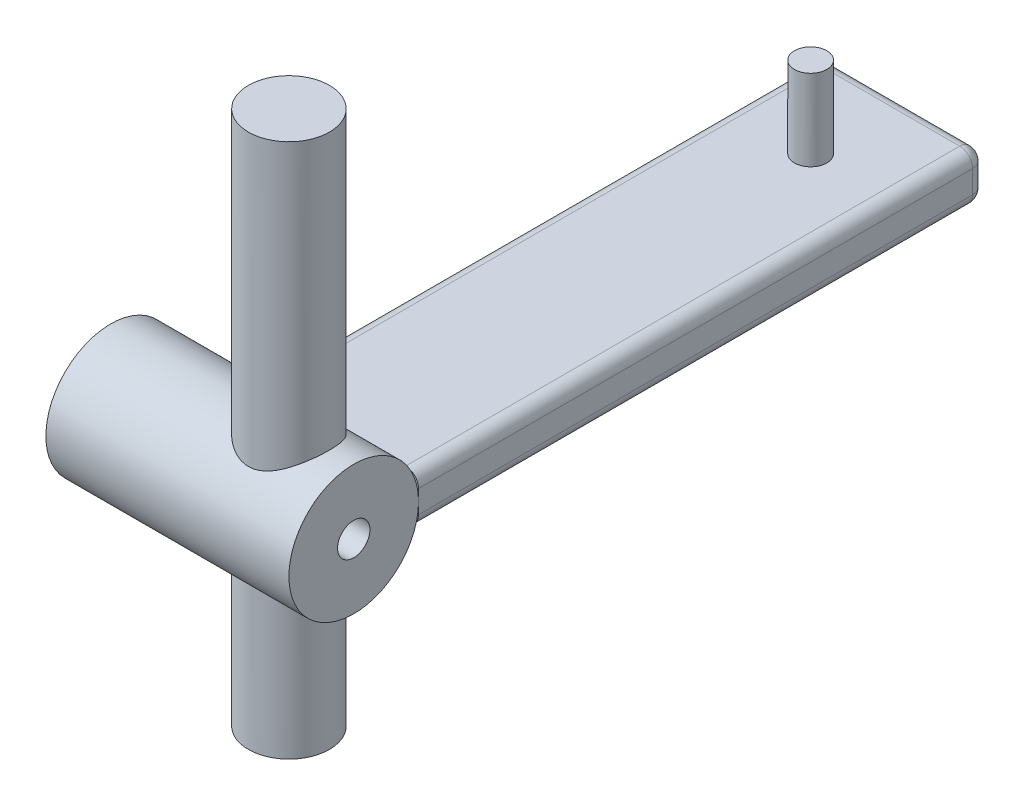
from build123d import *

# Parameters (mm, degrees)
SKETCH2_R           = 4
SKETCH2_R_2         = 1
BOSS_EXTRUDE1_DEPTH = 15
SKETCH4_R           = 2.5
BOSS_EXTRUDE2_DEPTH = 17
SKETCH6_R           = 2.5
BOSS_EXTRUDE3_DEPTH = 16
SKETCH8_R           = 1
CUT_EXTRUDE1_DEPTH  = 27.115129868
SKETCH12_W          = 10
SKETCH12_H          = 3
BOSS_EXTRUDE6_DEPTH = 35
FILLET2_R           = 0.8
SKETCH13_R          = 1
BOSS_EXTRUDE7_DEPTH = 5


with BuildPart() as part:
    # Sketch2 → Boss-Extrude1 (new body)
    with BuildSketch(Plane(origin=(0, 0, 0), x_dir=(0, 0, -1), z_dir=(1, 0, 0))):
        Circle(SKETCH2_R)
        Circle(SKETCH2_R_2, mode=Mode.SUBTRACT)
    extrude(amount=BOSS_EXTRUDE1_DEPTH)



with BuildPart() as body_2:
    # Sketch4 → Boss-Extrude2 (new body)
    with BuildSketch(Plane(origin=(15, 4, 0), x_dir=(1, 0, 0), z_dir=(0, 1, 0))):
        with Locations(Location((-4, 0, 0), (0, 0, 270))):
            Circle(SKETCH4_R)
    extrude(amount=BOSS_EXTRUDE2_DEPTH)


with BuildPart() as part_1:
    add(part.part)

    add(body_2.part)  # Boss-Extrude3 merges body 2
    # Sketch6 → Boss-Extrude3 (add)
    with BuildSketch(Plane.XZ.offset(-4)):
        with Locations(Location((11, 0, 0), (0, 0, 90))):
            Circle(SKETCH6_R)
    extrude(amount=BOSS_EXTRUDE3_DEPTH)

    # Sketch8 → Cut-Extrude1 (cut, through all)
    with BuildSketch(Plane(origin=(15, 0, 0), x_dir=(0, 0, -1), z_dir=(1, 0, 0))):
        Circle(SKETCH8_R)
    extrude(amount=-CUT_EXTRUDE1_DEPTH, mode=Mode.SUBTRACT)


with BuildPart() as body_2_2:
    # Sketch12 → Boss-Extrude6 (new body)
    with BuildSketch(Plane(origin=(15, 0, -4), x_dir=(-1, 0, 0), z_dir=(0, 0, -1))):
        with Locations((5, 0)):
            Rectangle(SKETCH12_W, SKETCH12_H)
    extrude(amount=BOSS_EXTRUDE6_DEPTH)

    # Fillet2
    fillet2_edges = [body_2_2.edges().sort_by_distance(p)[0] for p in [
        (10, -1.5, -39),
        (5, 0, -39),
        (10, 1.5, -39),
        (5, 1.5, -21.5),
        (5, -1.5, -21.5),
        (15, -1.5, -21.5),
        (15, 1.5, -21.5),
        (15, 0, -39),
    ]]
    fillet(fillet2_edges, radius=FILLET2_R)

    # Sketch13 → Boss-Extrude7 (add)
    with BuildSketch(Plane(origin=(0, 1.5, 0), x_dir=(1, 0, 0), z_dir=(0, 1, 0))):
        with Locations((10, 33.2)):
            Circle(SKETCH13_R)
    extrude(amount=BOSS_EXTRUDE7_DEPTH)


solid = Compound([part_1.part, body_2_2.part])
